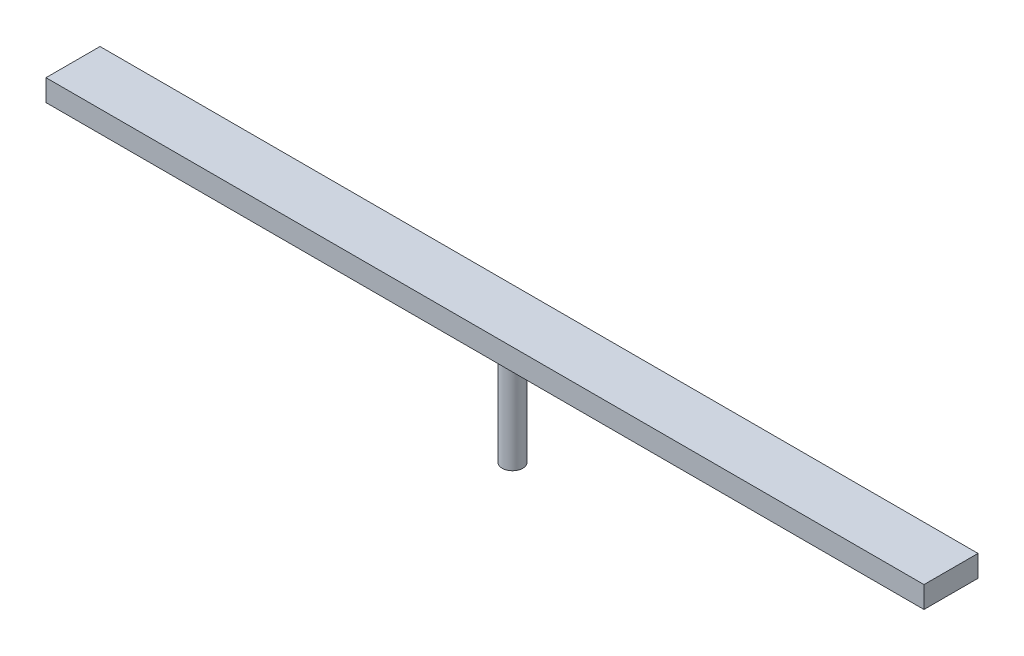
from build123d import *

# Parameters (mm, degrees)
SKETCH1_W           = 406.4
SKETCH1_H           = 10
BOSS_EXTRUDE1_DEPTH = 25
SKETCH2_R           = 4.75
BOSS_EXTRUDE2_DEPTH = 49


with BuildPart() as part:
    # Sketch1 → Boss-Extrude1 (new body)
    with BuildSketch(Plane.XY):
        with Locations((203.2, 5)):
            Rectangle(SKETCH1_W, SKETCH1_H)
    extrude(amount=BOSS_EXTRUDE1_DEPTH)

    # Sketch2 → Boss-Extrude2 (add)
    with BuildSketch(Plane.XZ):
        with Locations(Location((203.2, 12.25, 0), (0, 0, 90))):
            Circle(SKETCH2_R)
    extrude(amount=BOSS_EXTRUDE2_DEPTH)


solid = part.part
